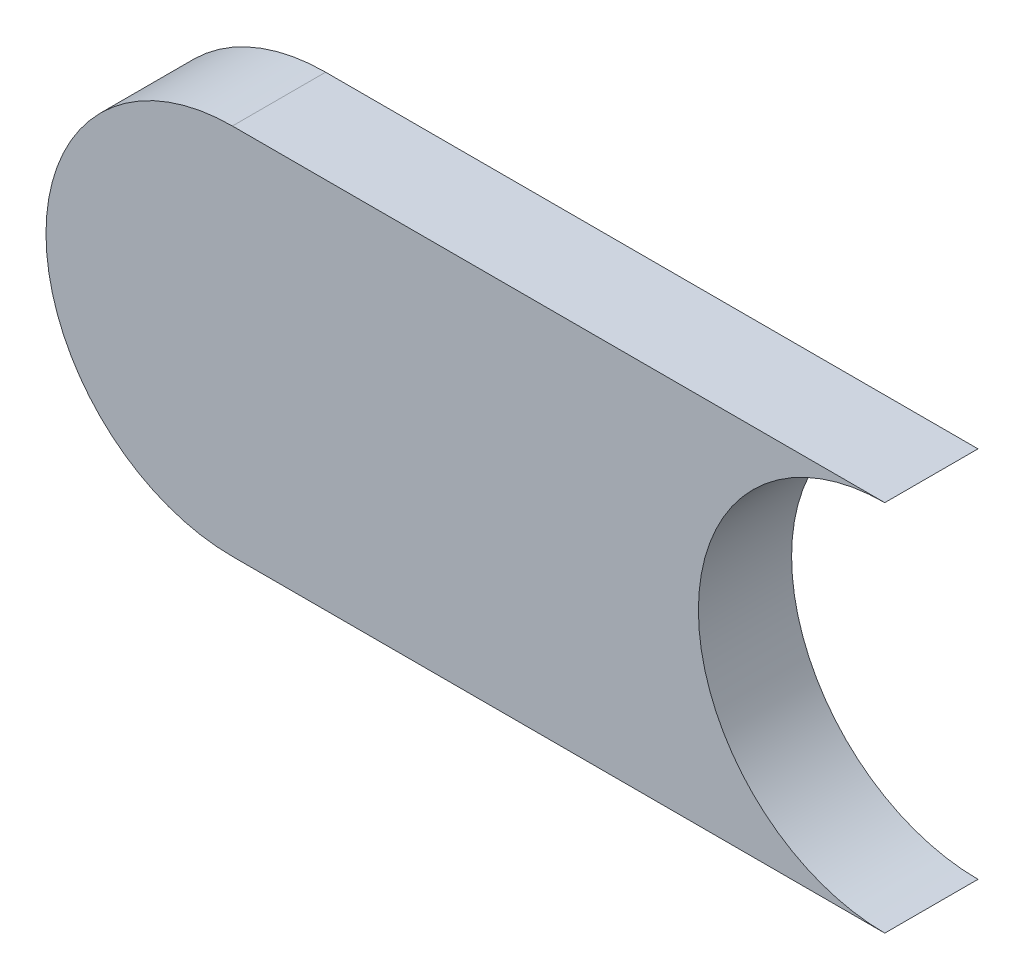
from build123d import *

# Parameters (mm, degrees)
BOSS_EXTRUDE1_DEPTH = 12.7


with BuildPart() as part:
    # Sketch1 → Boss-Extrude1 (new body)
    with BuildSketch(Plane.XY):
        with BuildLine():
            Line((0, 0), (88.9, 0))
            ThreePointArc((88.9, 0), (63.5, 25.4), (88.9, 50.8))
            Line((88.9, 50.8), (0, 50.8))
            ThreePointArc((0, 50.8), (-25.4, 25.4), (0, 0))
        make_face()
    extrude(amount=BOSS_EXTRUDE1_DEPTH)


solid = part.part
